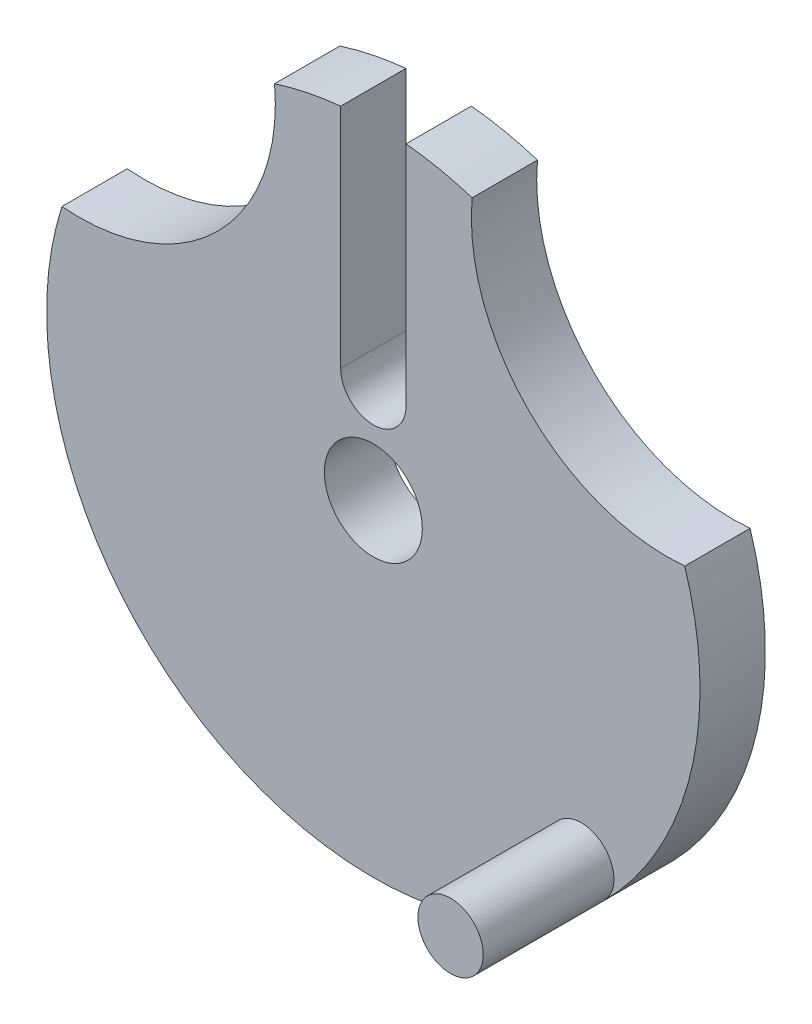
from build123d import *

# Parameters (mm, degrees)
SKETCH1_R           = 25
BOSS_EXTRUDE1_DEPTH = 5
SKETCH2_R           = 3.75
CUT_EXTRUDE1_DEPTH  = 36.707142143
SKETCH3_R           = 15
CUT_EXTRUDE2_DEPTH  = 36.707142143
SKETCH4_R           = 2.5
BOSS_EXTRUDE2_DEPTH = 10


with BuildPart() as part:
    # Sketch1 → Boss-Extrude1 (new body)
    with BuildSketch(Plane.XY):
        Circle(SKETCH1_R)
    extrude(amount=BOSS_EXTRUDE1_DEPTH)

    # Sketch2 → Cut-Extrude1 (cut, through all)
    with BuildSketch(Plane.XY.offset(5)):
        Circle(SKETCH2_R)
        with BuildLine():
            Line((-2.5, 7.5), (-2.5, 24.874685928))
            ThreePointArc((-2.5, 24.874685928), (0, 25), (2.5, 24.874685928))
            Line((2.5, 24.874685928), (2.5, 7.5))
            ThreePointArc((2.5, 7.5), (0, 5), (-2.5, 7.5))
        make_face()
    extrude(amount=-CUT_EXTRUDE1_DEPTH, mode=Mode.SUBTRACT)

    # Sketch3 → Cut-Extrude2 (cut, through all)
    with BuildSketch(Plane.XY.offset(5)):
        with Locations((22.5, 22.5)):
            Circle(SKETCH3_R)
        with Locations((-22.5, 22.5)):
            Circle(SKETCH3_R)
    extrude(amount=-CUT_EXTRUDE2_DEPTH, mode=Mode.SUBTRACT)

    # Sketch4 → Boss-Extrude2 (add)
    with BuildSketch(Plane.XY.offset(5)):
        with Locations(Location((15.909902577, -15.909902577, 0), (0, 0, 314.99945985))):
            Circle(SKETCH4_R)
    extrude(amount=BOSS_EXTRUDE2_DEPTH)


solid = part.part
